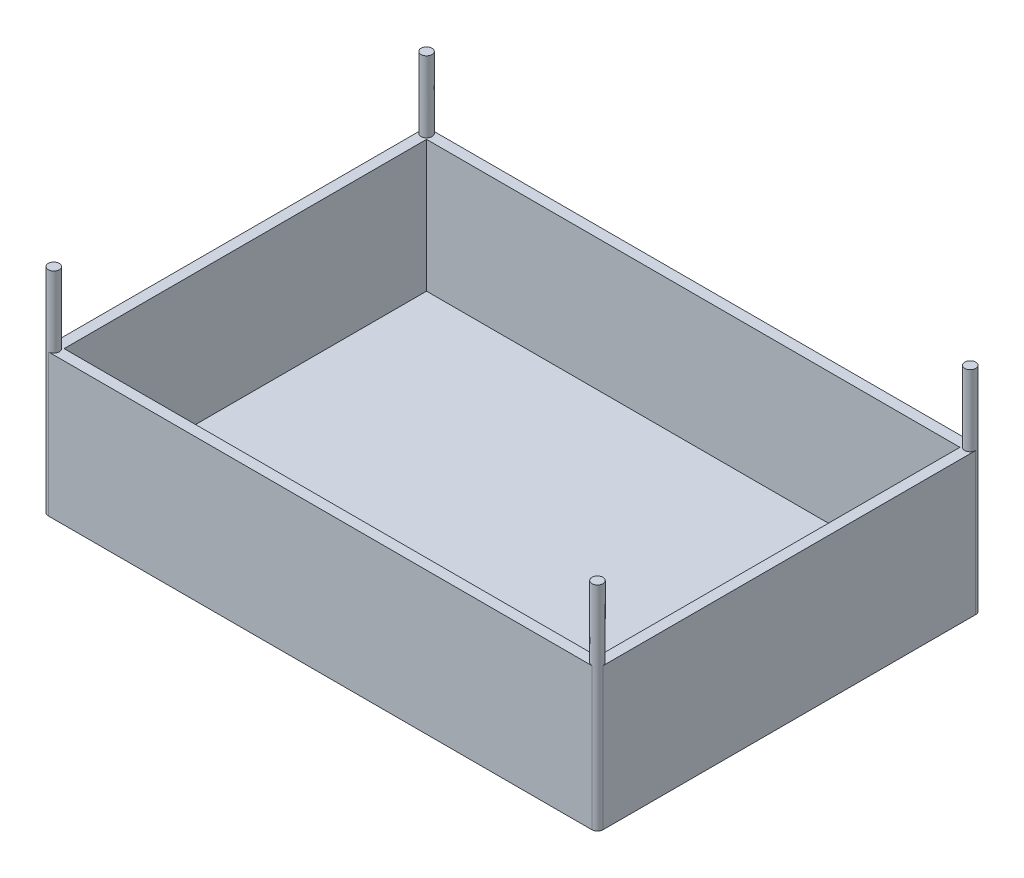
from build123d import *

# Parameters (mm, degrees)
SKETCH1_R             = 1.55
BOSS_EXTRUDE1_DEPTH   = 60
BOSS_EXTRUDE1_2_DEPTH = 60
BOSS_EXTRUDE1_3_DEPTH = 60
BOSS_EXTRUDE1_4_DEPTH = 60
BOSS_EXTRUDE2_DEPTH   = 40
SHELL1_T              = -3


with BuildPart() as part:
    # Sketch1 → Boss-Extrude1 (new body)
    with BuildSketch(Plane(origin=(0, 0, 0), x_dir=(1, 0, 0), z_dir=(0, 1, 0))):
        with Locations(Location((-76.5, 52.45, 0), (0, 0, 270))):
            Circle(SKETCH1_R)
    extrude(amount=BOSS_EXTRUDE1_DEPTH)



with BuildPart() as body_2:
    # Sketch1 → Boss-Extrude1 2 (new body)
    with BuildSketch(Plane(origin=(0, 0, 0), x_dir=(1, 0, 0), z_dir=(0, 1, 0))):
        with Locations(Location((76.5, 52.45, 0), (0, 0, 270))):
            Circle(SKETCH1_R)
    extrude(amount=BOSS_EXTRUDE1_2_DEPTH)


with BuildPart() as body_3:
    # Sketch1 → Boss-Extrude1 3 (new body)
    with BuildSketch(Plane(origin=(0, 0, 0), x_dir=(1, 0, 0), z_dir=(0, 1, 0))):
        with Locations(Location((76.5, -52.45, 0), (0, 0, 270))):
            Circle(SKETCH1_R)
    extrude(amount=BOSS_EXTRUDE1_3_DEPTH)


with BuildPart() as body_4:
    # Sketch1 → Boss-Extrude1 4 (new body)
    with BuildSketch(Plane(origin=(0, 0, 0), x_dir=(1, 0, 0), z_dir=(0, 1, 0))):
        with Locations(Location((-76.5, -52.45, 0), (0, 0, 270))):
            Circle(SKETCH1_R)
    extrude(amount=BOSS_EXTRUDE1_4_DEPTH)


with BuildPart() as part_1:
    add(part.part)

    add(body_2.part)  # Boss-Extrude2 merges body 2

    add(body_3.part)  # Boss-Extrude2 merges body 3

    add(body_4.part)  # Boss-Extrude2 merges body 4
    # Sketch2 → Boss-Extrude2 (add)
    with BuildSketch(Plane(origin=(0, 0, 0), x_dir=(1, 0, 0), z_dir=(0, 1, 0))):
        with BuildLine():
            Line((-78.05, 52.45), (-78.05, -52.45))
            ThreePointArc((-78.05, -52.45), (-77.596015511, -53.546015511), (-76.5, -54))
            Line((-76.5, -54), (76.5, -54))
            ThreePointArc((76.5, -54), (77.596015511, -53.546015511), (78.05, -52.45))
            Line((78.05, -52.45), (78.05, 52.45))
            ThreePointArc((78.05, 52.45), (77.596015511, 53.546015511), (76.5, 54))
            Line((76.5, 54), (-76.5, 54))
            ThreePointArc((-76.5, 54), (-77.596015511, 53.546015511), (-78.05, 52.45))
        make_face()
    extrude(amount=BOSS_EXTRUDE2_DEPTH)

    # Shell1
    shell1_openings = [part_1.faces().sort_by_distance(p)[0] for p in [
        (0, 40, 0),
    ]]
    offset(amount=SHELL1_T, openings=shell1_openings)


solid = part_1.part
